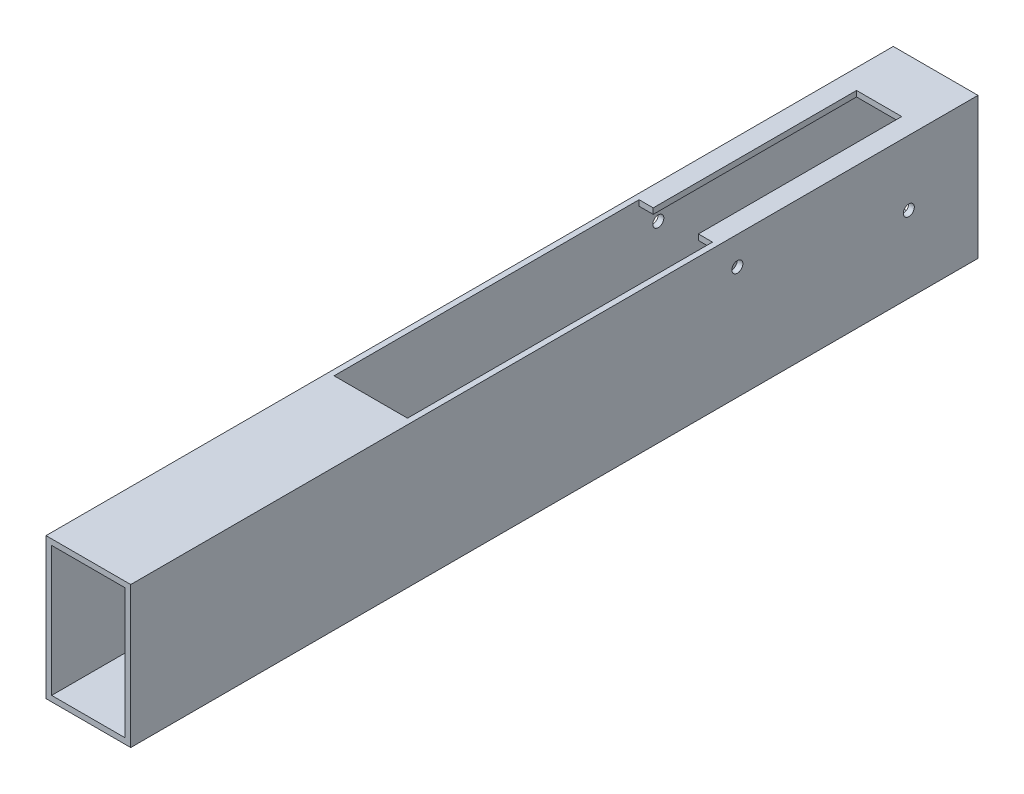
from build123d import *

# Parameters (mm, degrees)
SKETCH_1_W               = 30
SKETCH_1_H               = 50
SKETCH_1_W_2             = 26
SKETCH_1_H_2             = 46
EXTRUDE_1_DEPTH          = 300
CUT_EXTRUDE_2_DEPTH      = 302.413337462
CUT_EXTRUDE_2_DEPTH_BACK = 302.413337462
SKETCH_3_R               = 1.95
CUT_EXTRUDE_3_DEPTH      = 8
CUT_EXTRUDE_4_DEPTH      = 13
SKETCH_6_W               = 25
SKETCH_6_H               = 2
SKETCH_6_W_2             = 10.885639634
CUT_EXTRUDE_5_DEPTH      = 5
SKETCH_7_W               = 25
SKETCH_7_H               = 2
CUT_EXTRUDE_6_DEPTH      = 10


with BuildPart() as part:
    # 스케치1 → 보스-돌출1 (new body)
    with BuildSketch(Plane.XY):
        Rectangle(SKETCH_1_W, SKETCH_1_H)
        Rectangle(SKETCH_1_W_2, SKETCH_1_H_2, mode=Mode.SUBTRACT)
    extrude(amount=EXTRUDE_1_DEPTH)

    # 스케치3 → 컷-돌출2 (cut, two sides: drawn at the far end of the back side and taken through both)
    with BuildSketch(Plane(origin=(0, 0, 0), x_dir=(0, 0, -1), z_dir=(1, 0, 0)).offset(-CUT_EXTRUDE_2_DEPTH_BACK)):
        with Locations((-85.2, 15)):
            Circle(SKETCH_3_R)
        with Locations((-24.5, 2)):
            Circle(SKETCH_3_R)
    extrude(amount=CUT_EXTRUDE_2_DEPTH + CUT_EXTRUDE_2_DEPTH_BACK, mode=Mode.SUBTRACT)

    # 스케치4 → 컷-돌출3 (cut, symmetric)
    with BuildSketch(Plane(origin=(0, 0, 0), x_dir=(0, 0, -1), z_dir=(1, 0, 0))):
        Polygon((-20, 25), (-20, -23), (-48, -23), (-74, -23), (-97.25, -23), (-97.25, 25), align=None)
    extrude(amount=CUT_EXTRUDE_3_DEPTH, both=True, mode=Mode.SUBTRACT)

    # 스케치5 → 컷-돌출4 (cut, symmetric)
    with BuildSketch(Plane(origin=(0, 0, 0), x_dir=(0, 0, -1), z_dir=(1, 0, 0))):
        Polygon((-92, 23), (-92, 25), (-200, 25), (-200, -25), (-92, -25), align=None)
    extrude(amount=CUT_EXTRUDE_4_DEPTH, both=True, mode=Mode.SUBTRACT)

    # 스케치6 → 컷-돌출5 (cut, symmetric)
    with BuildSketch(Plane(origin=(0, 0, 0), x_dir=(0, 0, -1), z_dir=(1, 0, 0))):
        with Locations((-52.975965068, -24)):
            Rectangle(SKETCH_6_W, SKETCH_6_H)
        with Locations((-83.750343722, -24)):
            Rectangle(SKETCH_6_W_2, SKETCH_6_H)
    extrude(amount=CUT_EXTRUDE_5_DEPTH, both=True, mode=Mode.SUBTRACT)

    # 스케치7 → 컷-돌출6 (cut, symmetric)
    with BuildSketch(Plane(origin=(0, 0, 0), x_dir=(0, 0, -1), z_dir=(1, 0, 0))):
        with Locations((-12.5, -24)):
            Rectangle(SKETCH_7_W, SKETCH_7_H)
    extrude(amount=CUT_EXTRUDE_6_DEPTH, both=True, mode=Mode.SUBTRACT)


solid = part.part
